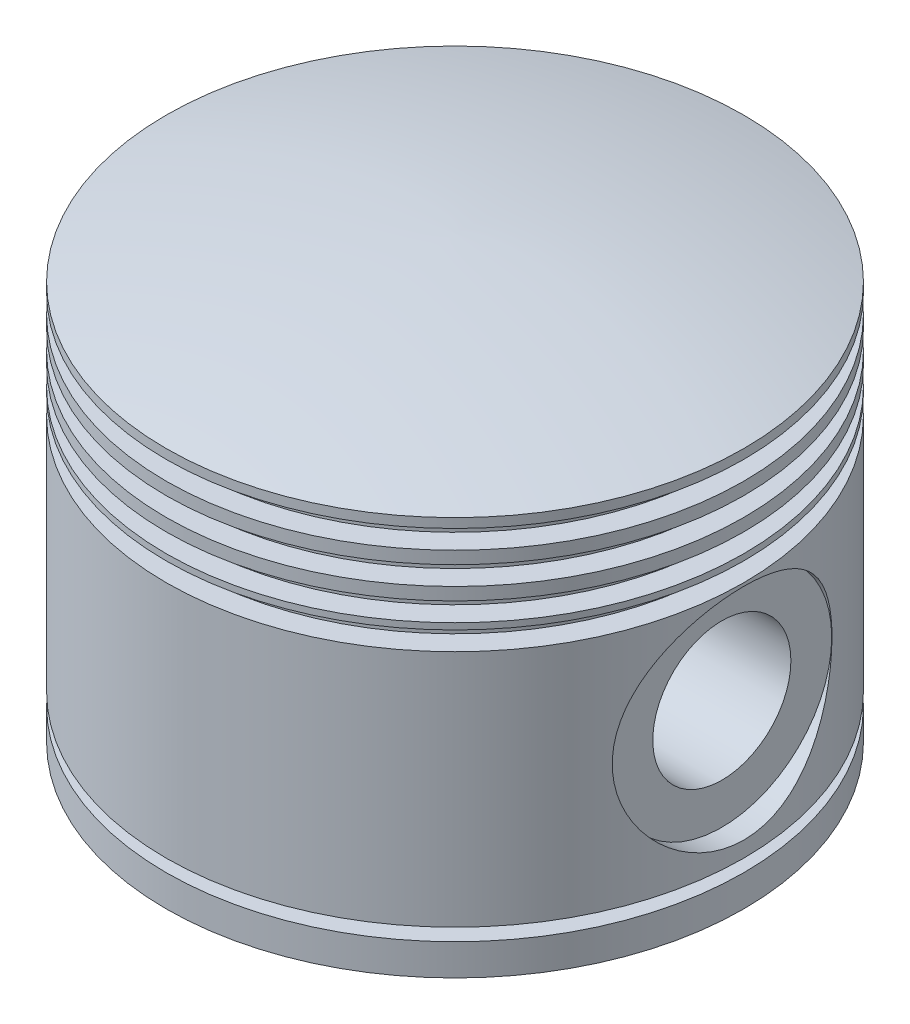
from build123d import *

# Parameters (mm, degrees)
CUT_EXTRUDE1_DEPTH       = 96.693429411
CUT_EXTRUDE1_DEPTH_BACK  = 96.693429411
SKETCH2_R                = 11
CUT_EXTRUDE6_START       = 46
SKETCH3_R                = 17.5
CUT_EXTRUDE6_DEPTH       = 3.5
BOSS_EXTRUDE1_REACH      = 122.693
BOSS_EXTRUDE1_END_RADIUS = 37
BOSS_EXTRUDE1_START      = -25
SKETCH4_R                = 18
SKETCH4_R_2              = 11


with BuildPart() as part:
    # Sketch1 → Revolve1 (revolve)
    with BuildSketch(Plane.XY, mode=Mode.PRIVATE) as revolve1_sk:
        with BuildLine():
            Line((-46, 63.5), (-46, 62))
            Line((-46, 62), (-42.5, 62))
            Line((-42.5, 62), (-42.5, 59))
            Line((-42.5, 59), (-46, 59))
            Line((-46, 59), (-46, 57))
            Line((-46, 57), (-42.5, 57))
            Line((-42.5, 57), (-42.5, 54))
            Line((-42.5, 54), (-46, 54))
            Line((-46, 54), (-46, 52))
            Line((-46, 52), (-42.5, 52))
            Line((-42.5, 52), (-42.5, 49))
            Line((-42.5, 49), (-46, 49))
            Line((-46, 49), (-46, 48))
            Line((-46, 48), (-42.5, 48))
            Line((-42.5, 48), (-42.5, 45))
            Line((-42.5, 45), (-46, 45))
            Line((-46, 45), (-46, 7))
            Line((-46, 7), (-42.5, 7))
            Line((-42.5, 7), (-42.5, 5))
            Line((-42.5, 5), (-46, 5))
            Line((-46, 5), (-46, 0))
            Line((-46, 0), (-37, 0))
            Line((-37, 0), (-37, 62))
            Line((-37, 62), (0, 62))
            Line((0, 62), (0, 70.18))
            ThreePointArc((0, 70.18), (-23.206141435, 68.259536828), (-46, 63.5))
        make_face()
    revolve(revolve1_sk.sketch.rotate(Axis((0, 0, 0), (0, 1, 0)), 270), axis=Axis((0, 0, 0), (0, 1, 0)))

    # Sketch2 → Cut-Extrude1 (cut, two sides: drawn at the far end of the back side and taken through both)
    with BuildSketch(Plane(origin=(0, 0, 0), x_dir=(0, 0, -1), z_dir=(1, 0, 0)).offset(-CUT_EXTRUDE1_DEPTH_BACK)):
        with Locations((0, 27)):
            Circle(SKETCH2_R)
    extrude(amount=CUT_EXTRUDE1_DEPTH + CUT_EXTRUDE1_DEPTH_BACK, mode=Mode.SUBTRACT)

    # Sketch3 → Cut-Extrude6 (cut)
    with BuildSketch(Plane(origin=(0, 0, 0), x_dir=(0, 0, -1), z_dir=(1, 0, 0)).offset(CUT_EXTRUDE6_START)):
        with Locations((0, 27)):
            Circle(SKETCH3_R)
    cut_extrude6 = extrude(amount=-CUT_EXTRUDE6_DEPTH, mode=Mode.SUBTRACT)

    # Mirror1: Cut-Extrude6 across plane
    add(cut_extrude6.mirror(Plane(origin=(0, 0, 0), x_dir=(0, 0, 1), z_dir=(1, 0, 0))), mode=Mode.SUBTRACT)

    # Boss-Extrude1: up to this cylinder (the profile starts inside it)
    boss_extrude1_end = Plane(origin=(0, 27, 0), z_dir=(0, -1, 0)) * Cylinder(BOSS_EXTRUDE1_END_RADIUS, 320.386, mode=Mode.PRIVATE)
    # Sketch4 → Boss-Extrude1 (add, up to the surface)
    with BuildSketch(Plane(origin=(0, 0, 0), x_dir=(0, 0, -1), z_dir=(1, 0, 0)).offset(BOSS_EXTRUDE1_START), mode=Mode.PRIVATE) as boss_extrude1_sk1:
        with Locations((0, 27)):
            Circle(SKETCH4_R)
        with Locations((0, 27)):
            Circle(SKETCH4_R_2, mode=Mode.SUBTRACT)
    boss_extrude1_tool1 = extrude(boss_extrude1_sk1.sketch, amount=-BOSS_EXTRUDE1_REACH, mode=Mode.PRIVATE) & boss_extrude1_end
    boss_extrude1 = boss_extrude1_tool1.solids().sort_by_distance((-25, 27, 17.490883))[0]
    add(boss_extrude1)

    # Mirror2: Boss-Extrude1 across plane
    add(boss_extrude1.mirror(Plane(origin=(0, 0, 0), x_dir=(0, 0, 1), z_dir=(1, 0, 0))))


solid = part.part
